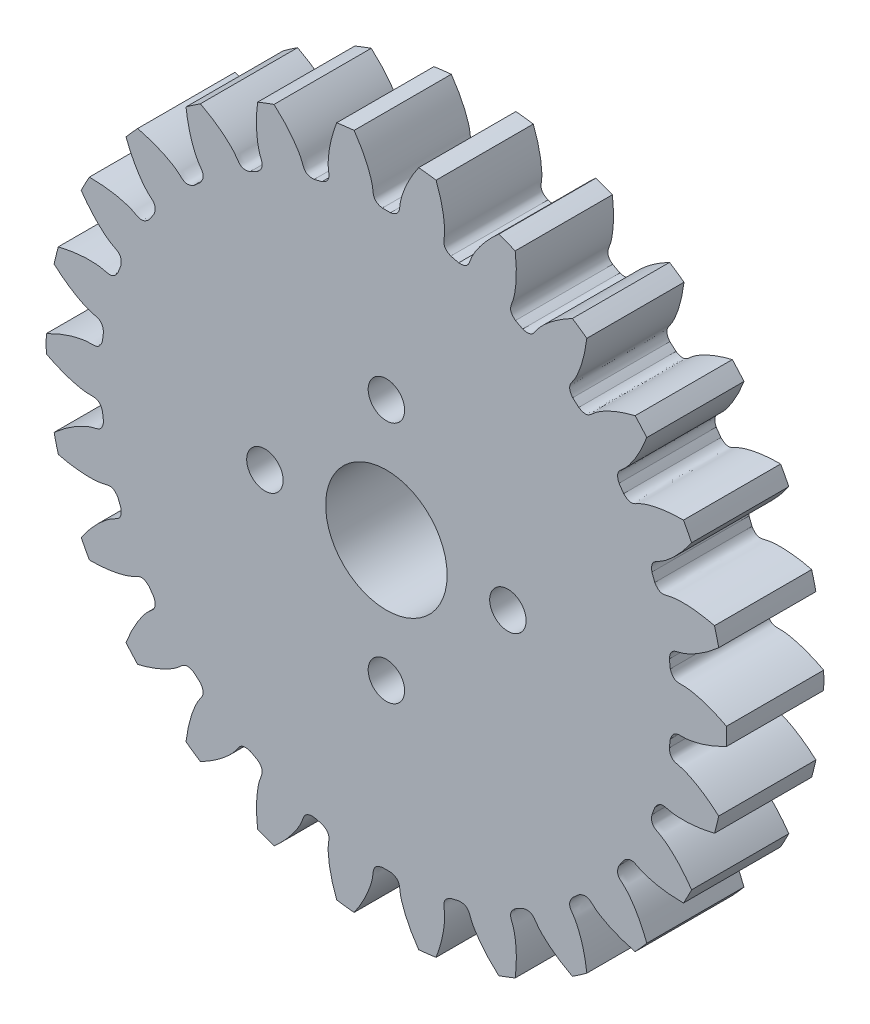
from build123d import *

# Parameters (mm, degrees)
SKETCH_1_R               = 28
EXTRUDE_1_DEPTH          = 8
CUT_EXTRUDE_1_DEPTH      = 41.398019753
PATTERN_CIRCULAR_1_COUNT = 26
SKETCH_4_R               = 5
SKETCH_4_R_2             = 1.5
CUT_EXTRUDE_2_DEPTH      = 10


with BuildPart() as part:
    # 草图1 → 凸台-拉伸1 (new body)
    with BuildSketch(Plane.XY):
        Circle(SKETCH_1_R)
    extrude(amount=EXTRUDE_1_DEPTH)

    # 草图2 → 切除-拉伸1 (cut, through all)
    with BuildSketch(Plane.XY):
        with BuildLine():
            ThreePointArc((0.334166203, 23.497623985), (0, 23.5), (-0.334166203, 23.497623985))
            add(Edge.make_bspline(
                [(-0.334166203, 23.497623985), (-1.126249154, 23.647573059), (-1.060682993, 24.115894486), (-1.134806649, 24.58436917), (-1.145940464, 24.646912416), (-1.160233381, 24.718805072), (-1.178047812, 24.799945437), (-1.199763487, 24.890216464), (-1.225750213, 24.989491134), (-1.256376305, 25.097630828), (-1.292005509, 25.214485967), (-1.332997575, 25.339895945), (-1.379707694, 25.473689291), (-1.432486291, 25.615683768), (-1.491678707, 25.765686504), (-1.557624929, 25.923494124), (-1.6306593, 26.088892886), (-1.711110243, 26.261658827), (-1.79929999, 26.441557916), (-1.895544305, 26.628346218), (-2.000152224, 26.821770052), (-2.113425787, 27.02156617), (-2.235659783, 27.227461935), (-2.367141495, 27.439175509), (-2.508150449, 27.656416042), (-2.658958171, 27.878883872), (-2.819827949, 28.106270733), (-2.991014594, 28.338259962), (-3.172764214, 28.574526716), (-3.365313988, 28.8147382), (-3.568891947, 29.058553888), (-3.783716762, 29.305625763), (-4.009997535, 29.555598554), (-4.2479336, 29.80810998), (-4.497714323, 30.062791), (-4.759518919, 30.31926607), (-5.033516256, 30.5771534), (-5.31986471, 30.836065219), (-5.618711894, 31.095608048), (-6.039026251, 31.446147682), (-6.365991342, 31.702419987), (-6.589818312, 31.870903728)],
                knots=[0, 0, 0, 0, 0.122665365, 0.127715434, 0.133683697, 0.140570154, 0.148374806, 0.157097651, 0.166738691, 0.177297926, 0.188775354, 0.201170977, 0.214484794, 0.228716806, 0.243867011, 0.259935411, 0.276922005, 0.294826794, 0.313649777, 0.333390954, 0.354050325, 0.37562789, 0.39812365, 0.421537604, 0.445869753, 0.471120096, 0.497288632, 0.524375364, 0.552380289, 0.581303409, 0.611144723, 0.641904231, 0.673581934, 0.706177831, 0.739691922, 0.774124208, 0.809474687, 0.845743361, 0.88293023, 0.921035292, 1, 1, 1, 1], degree=3))
            ThreePointArc((-6.589818312, 31.870903728), (0, 32.54504893), (6.589818312, 31.870903728))
            add(Edge.make_bspline(
                [(0.334166203, 23.497623985), (1.126249154, 23.647573059), (1.060682993, 24.115894486), (1.134806649, 24.58436917), (1.145940464, 24.646912416), (1.160233381, 24.718805072), (1.178047812, 24.799945437), (1.199763487, 24.890216464), (1.225750213, 24.989491134), (1.256376305, 25.097630828), (1.292005509, 25.214485967), (1.332997575, 25.339895945), (1.379707694, 25.473689291), (1.432486291, 25.615683768), (1.491678707, 25.765686504), (1.557624929, 25.923494124), (1.6306593, 26.088892886), (1.711110243, 26.261658827), (1.79929999, 26.441557916), (1.895544305, 26.628346218), (2.000152224, 26.821770052), (2.113425787, 27.02156617), (2.235659783, 27.227461935), (2.367141495, 27.439175509), (2.508150449, 27.656416042), (2.658958171, 27.878883872), (2.819827949, 28.106270733), (2.991014594, 28.338259962), (3.172764214, 28.574526716), (3.365313988, 28.8147382), (3.568891947, 29.058553888), (3.783716762, 29.305625763), (4.009997535, 29.555598554), (4.2479336, 29.80810998), (4.497714323, 30.062791), (4.759518919, 30.31926607), (5.033516256, 30.5771534), (5.31986471, 30.836065219), (5.618711894, 31.095608048), (6.039026251, 31.446147682), (6.365991342, 31.702419987), (6.589818312, 31.870903728)],
                knots=[0, 0, 0, 0, 0.122665365, 0.127715434, 0.133683697, 0.140570154, 0.148374806, 0.157097651, 0.166738691, 0.177297926, 0.188775354, 0.201170977, 0.214484794, 0.228716806, 0.243867011, 0.259935411, 0.276922005, 0.294826794, 0.313649777, 0.333390954, 0.354050325, 0.37562789, 0.39812365, 0.421537604, 0.445869753, 0.471120096, 0.497288632, 0.524375364, 0.552380289, 0.581303409, 0.611144723, 0.641904231, 0.673581934, 0.706177831, 0.739691922, 0.774124208, 0.809474687, 0.845743361, 0.88293023, 0.921035292, 1, 1, 1, 1], degree=3))
        make_face()
    cut_extrude_1 = extrude(amount=CUT_EXTRUDE_1_DEPTH, mode=Mode.SUBTRACT)

    # 阵列(圆周)1: 切除-拉伸1 ×26 about axis
    pattern_circular_1_axis = Axis((0, 0, 8), (0, 0, -1))
    for i in range(1, PATTERN_CIRCULAR_1_COUNT):
        add(cut_extrude_1.rotate(pattern_circular_1_axis, i * 360 / PATTERN_CIRCULAR_1_COUNT), mode=Mode.SUBTRACT)

    # 草图4 → 切除-拉伸2 (cut)
    with BuildSketch(Plane.XY.offset(8)):
        Circle(SKETCH_4_R)
        with Locations((0, 10)):
            Circle(SKETCH_4_R_2)
        with Locations((10, 0)):
            Circle(SKETCH_4_R_2)
        with Locations((0, -10)):
            Circle(SKETCH_4_R_2)
        with Locations((-10, 0)):
            Circle(SKETCH_4_R_2)
    extrude(amount=-CUT_EXTRUDE_2_DEPTH, mode=Mode.SUBTRACT)


solid = part.part
